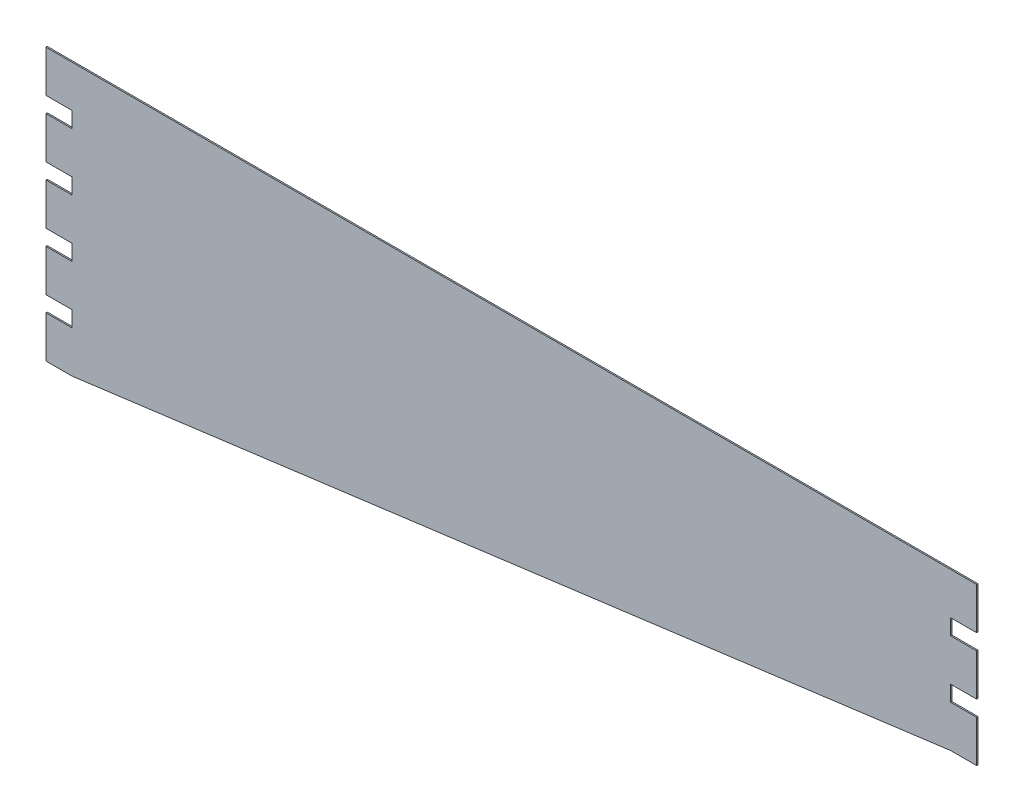
from build123d import *

# Parameters (mm, degrees)
BOSS_EXTRUDE1_DEPTH  = 0.125
SKETCH4_W            = 5
SKETCH4_H            = 3
CUT_EXTRUDE2_DEPTH   = 186.440185774
LPATTERN3_COUNT      = 4
LPATTERN3_PITCH      = 11
LPATTERN3_COUNT_DIR2 = 2
LPATTERN3_PITCH_DIR2 = 173


with BuildPart() as part:
    # Sketch2 → Boss-Extrude1 (new, symmetric)
    with BuildSketch(Plane.XY):
        Polygon((0, 0), (5, 0), (173, 22), (178, 22), (178, 52), (0, 52), align=None)
    extrude(amount=BOSS_EXTRUDE1_DEPTH, both=True)

    # Sketch4 → Cut-Extrude2 (cut, through all)
    with BuildSketch(Plane.XY.offset(0.125)):
        with Locations((175.5, 42.5)):
            Rectangle(SKETCH4_W, SKETCH4_H)
    cut_extrude2 = extrude(amount=-CUT_EXTRUDE2_DEPTH, mode=Mode.SUBTRACT)

    # LPattern3: Cut-Extrude2 4 × 2
    with Locations(*[(-j * LPATTERN3_PITCH_DIR2, -i * LPATTERN3_PITCH, 0) for i in range(LPATTERN3_COUNT) for j in range(LPATTERN3_COUNT_DIR2) if (i, j) != (0, 0)]):
        add(cut_extrude2, mode=Mode.SUBTRACT)


solid = part.part
